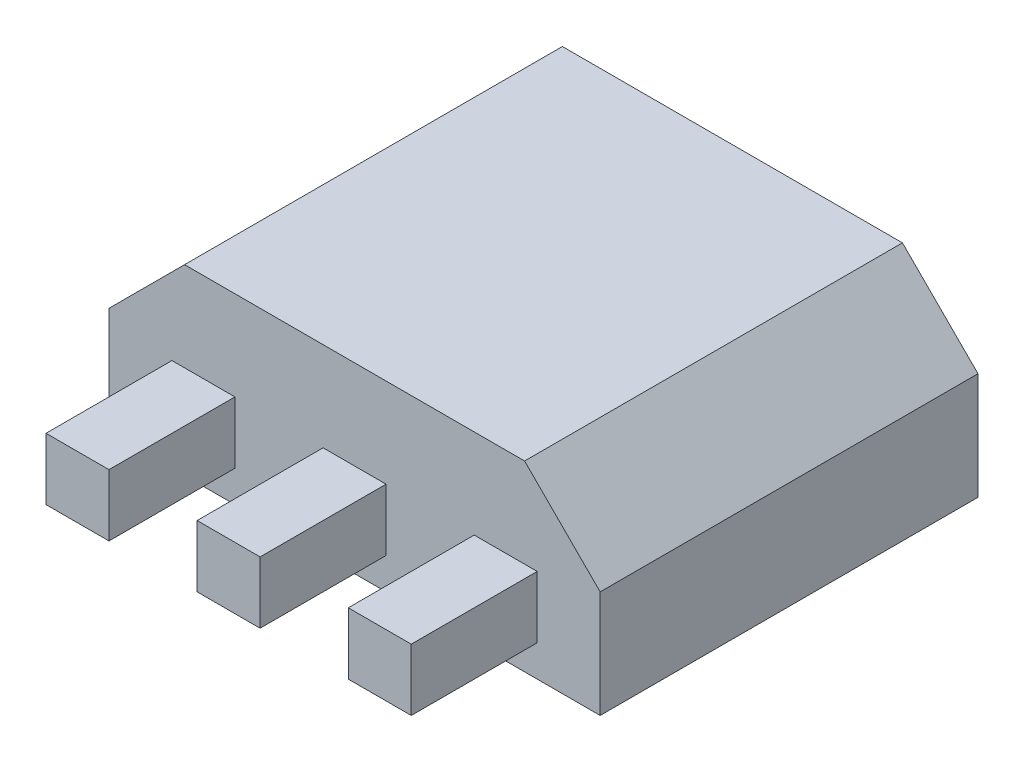
from build123d import *

# Parameters (mm, degrees)
SKETCH1_W           = 3.9
SKETCH1_H           = 3
BOSS_EXTRUDE1_DEPTH = 1.45
CHAMFER1_SIZE       = 0.6
SKETCH2_W           = 0.5
SKETCH2_H           = 0.490574161
BOSS_EXTRUDE2_DEPTH = 1


with BuildPart() as part:
    # Sketch1 → Boss-Extrude1 (new body)
    with BuildSketch(Plane(origin=(0, 0, 0), x_dir=(1, 0, 0), z_dir=(0, 1, 0))):
        with Locations((1.95, 1.5)):
            Rectangle(SKETCH1_W, SKETCH1_H)
    extrude(amount=BOSS_EXTRUDE1_DEPTH)

    # Chamfer1
    chamfer1_edges = [part.edges().sort_by_distance(p)[0] for p in [
        (3.9, 1.45, -1.5),
        (0, 1.45, -1.5),
    ]]
    chamfer(chamfer1_edges, length=CHAMFER1_SIZE)

    # Sketch2 → Boss-Extrude2 (add)
    with BuildSketch(Plane.XY):
        with Locations((0.75, 0.495287081)):
            Rectangle(SKETCH2_W, SKETCH2_H)
        with Locations((1.95, 0.495287081)):
            Rectangle(SKETCH2_W, SKETCH2_H)
        with Locations((3.15, 0.495287081)):
            Rectangle(SKETCH2_W, SKETCH2_H)
    extrude(amount=BOSS_EXTRUDE2_DEPTH)


solid = part.part
